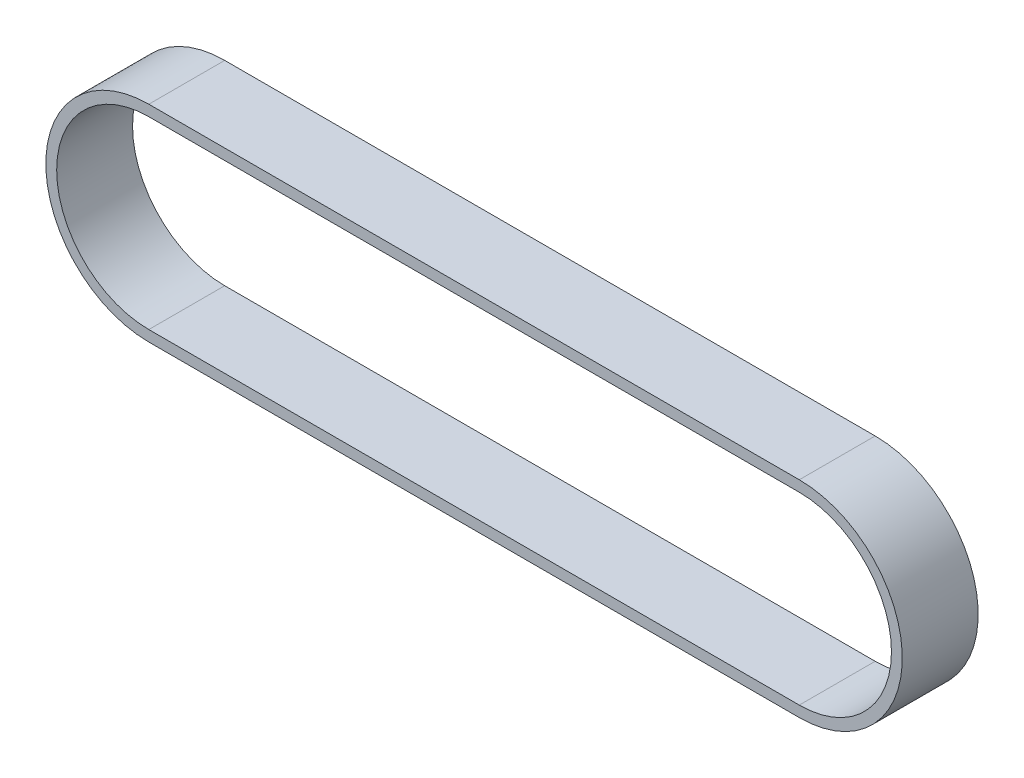
from build123d import *

# Parameters (mm, degrees)
EXTRUDE_1_DEPTH = 7


with BuildPart() as part:
    # 草图1 → 拉伸-薄壁1 (new, symmetric)
    with BuildSketch(Plane.XY):
        with BuildLine():
            Line((73.945454545, -19), (-46.054545455, -19))
            ThreePointArc((-46.054545455, -19), (-65.054545455, 0), (-46.054545455, 19))
            Line((-46.054545455, 19), (73.945454545, 19))
            ThreePointArc((73.945454545, 19), (92.945454545, 0), (73.945454545, -19))
        make_face()
        with BuildLine():
            Line((73.945454545, -17), (-46.054545455, -17))
            ThreePointArc((-46.054545455, -17), (-63.054545455, 0), (-46.054545455, 17))
            Line((-46.054545455, 17), (73.945454545, 17))
            ThreePointArc((73.945454545, 17), (90.945454545, 0), (73.945454545, -17))
        make_face(mode=Mode.SUBTRACT)
    extrude(amount=EXTRUDE_1_DEPTH, both=True)


solid = part.part
